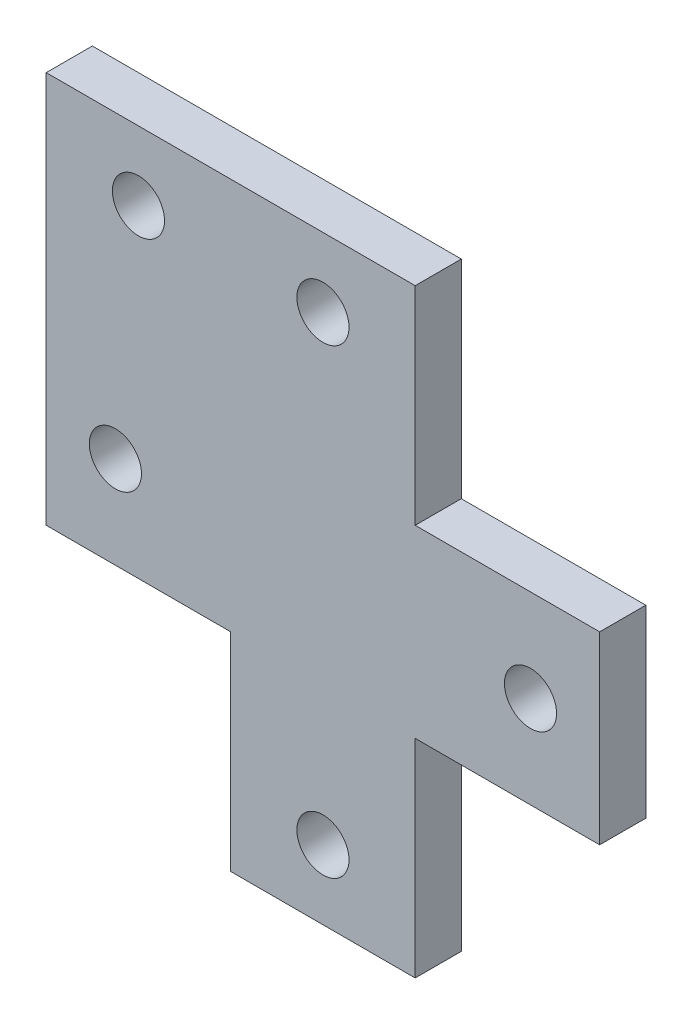
from build123d import *

# Parameters (mm, degrees)
SKETCH3_R             = 1
BOSS_EXTRUDE1_DEPTH   = 2
F_4_40_TAPPED_HOLE1_D = 2.2606


with BuildPart() as part:
    # Sketch3 → Boss-Extrude1 (new body)
    with BuildSketch(Plane.XY):
        Polygon((8, 0), (-8, 0), (-8, -17), (0, -17), (0, -26), (8, -26), (8, -17), (16, -17), (16, -9), (8, -9), align=None)
        with Locations((4, -3)):
            Circle(SKETCH3_R, mode=Mode.SUBTRACT)
        with Locations((-4, -3)):
            Circle(SKETCH3_R, mode=Mode.SUBTRACT)
        with Locations((-5, -13)):
            Circle(SKETCH3_R, mode=Mode.SUBTRACT)
        with Locations((13, -13)):
            Circle(SKETCH3_R, mode=Mode.SUBTRACT)
        with Locations((4, -23)):
            Circle(SKETCH3_R, mode=Mode.SUBTRACT)
    extrude(amount=BOSS_EXTRUDE1_DEPTH)

    # #4-40 Tapped Hole1 (through all)
    with Locations(Plane(origin=(-5, -13, 2), x_dir=(1, 0, 0), z_dir=(0, 0, 1))):
        with Locations((0, 0), (18, 0), (9, -10), (9, 10), (1, 10)):
            Hole(F_4_40_TAPPED_HOLE1_D / 2)


solid = part.part
